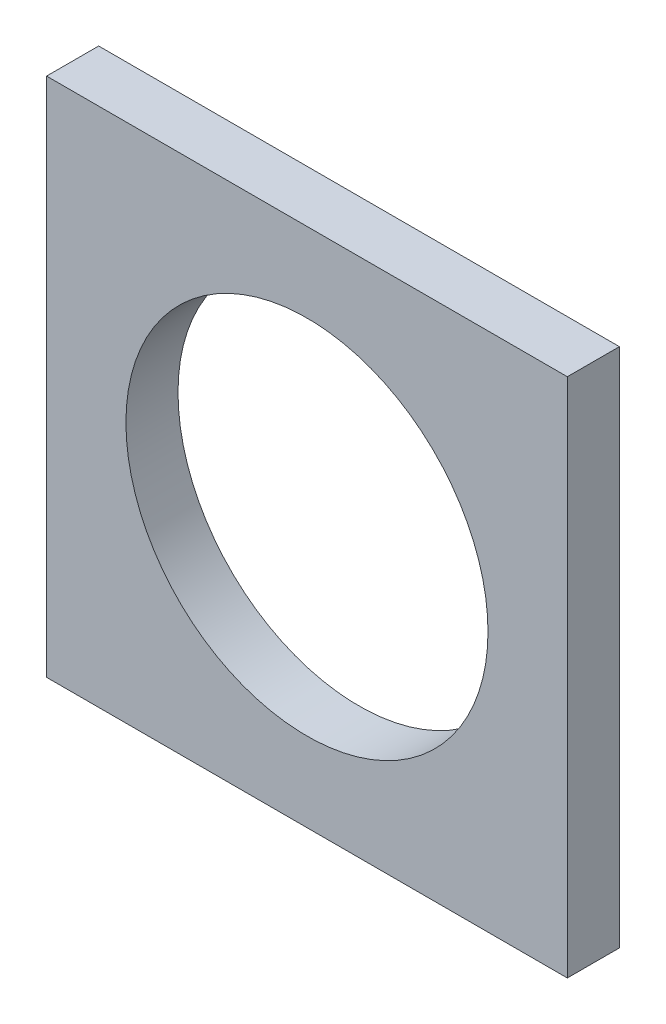
from build123d import *

# Parameters (mm, degrees)
SKETCH_1_W      = 100
SKETCH_1_H      = 100
SKETCH_1_R      = 34.764618621
EXTRUDE_1_DEPTH = 10


with BuildPart() as part:
    # 草图1 → 凸台-拉伸1 (new body)
    with BuildSketch(Plane.XY):
        Rectangle(SKETCH_1_W, SKETCH_1_H)
        Circle(SKETCH_1_R, mode=Mode.SUBTRACT)
    extrude(amount=EXTRUDE_1_DEPTH)


solid = part.part
